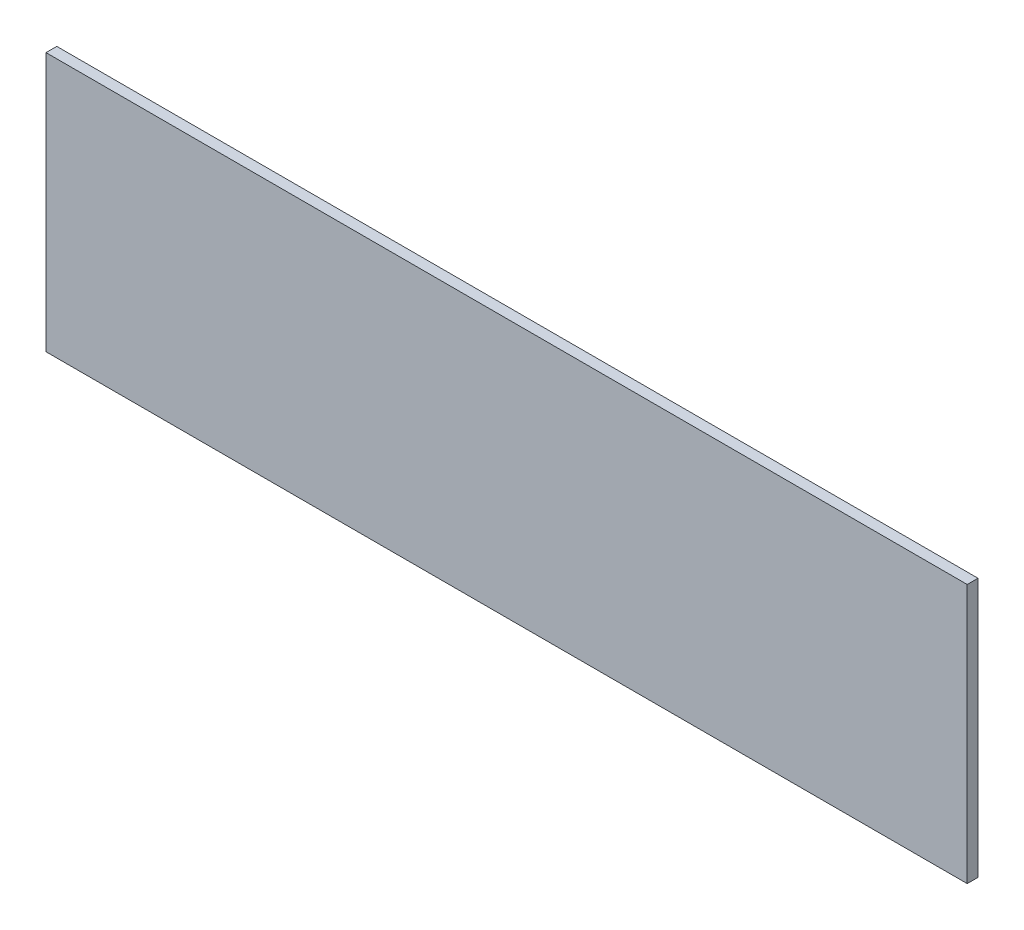
from build123d import *

# Parameters (mm, degrees)
SKETCH1_W           = 406.4
SKETCH1_H           = 114.3
BOSS_EXTRUDE1_DEPTH = 4.7625


with BuildPart() as part:
    # Sketch1 → Boss-Extrude1 (new body)
    with BuildSketch(Plane.XY):
        with Locations((203.2, 57.15)):
            Rectangle(SKETCH1_W, SKETCH1_H)
    extrude(amount=BOSS_EXTRUDE1_DEPTH)


solid = part.part
